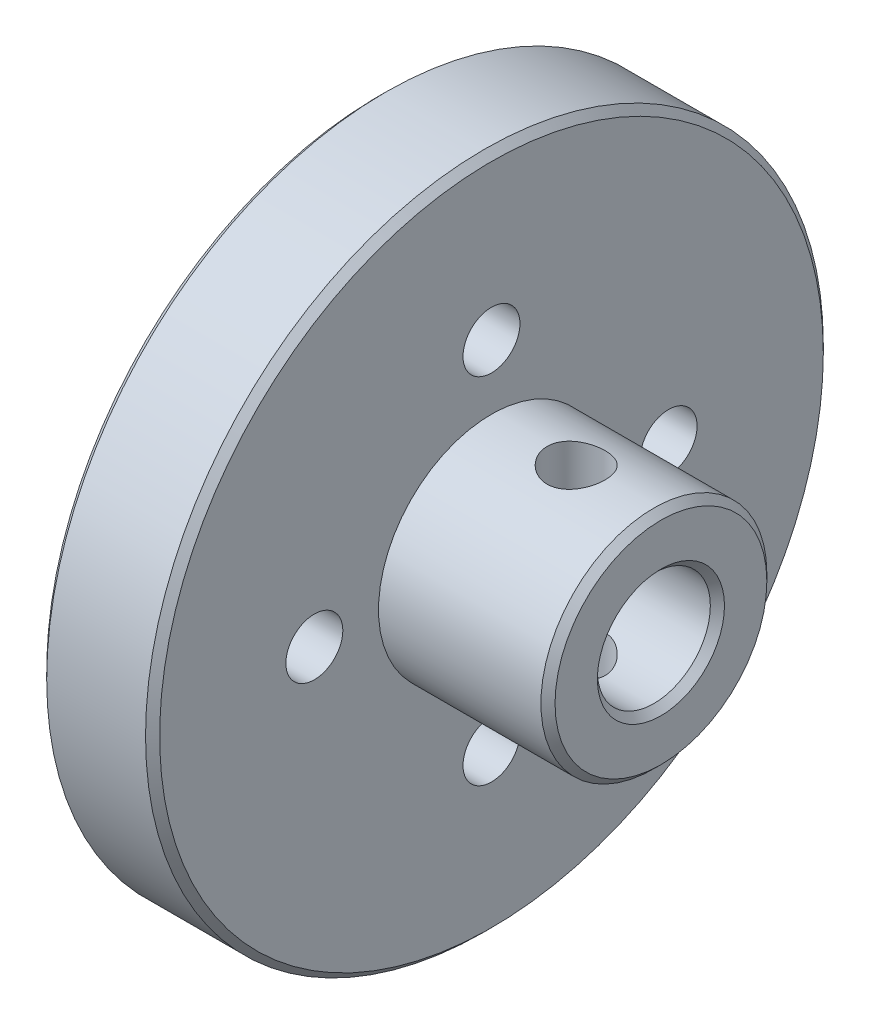
from build123d import *

# Parameters (mm, degrees)
CUT_EXTRUDE1_DEPTH      = 32.270123521
CUT_EXTRUDE1_DEPTH_BACK = 32.270123521
SKETCH3_R               = 1.63195
SKETCH2_R               = 1.6
CUT_EXTRUDE2_DEPTH      = 32.270123571
CHAMFER1_SIZE           = 0.396875


with BuildPart() as part:
    # Sketch1 → Revolve1 (revolve)
    with BuildSketch(Plane.XY):
        Polygon((0, 3.175), (0, 6.35), (-9.525, 6.35), (-9.525, 19.05), (-15.875, 19.05), (-15.875, 4.5), (-14.0716, 4.5), (-14.0716, 3.175), align=None)
    revolve(axis=Axis((0, 0, 0), (-1, 0, 0)))

    # Sketch3 → Cut-Extrude1 (cut, two sides: drawn at the far end of the back side and taken through both)
    with BuildSketch(Plane(origin=(0, 0, 0), x_dir=(1, 0, 0), z_dir=(0, 1, 0)).offset(-CUT_EXTRUDE1_DEPTH_BACK)):
        with Locations((-4.7625, 0)):
            Circle(SKETCH3_R)
    extrude(amount=CUT_EXTRUDE1_DEPTH + CUT_EXTRUDE1_DEPTH_BACK, mode=Mode.SUBTRACT)

    # Sketch2 → Cut-Extrude2 (cut, through all)
    with BuildSketch(Plane.ZY.offset(15.875)):
        with Locations((-9.9568, 0)):
            Circle(SKETCH2_R)
        with Locations((0, 9.9568)):
            Circle(SKETCH2_R)
        with Locations((9.9568, 0)):
            Circle(SKETCH2_R)
        with Locations((0, -9.9568)):
            Circle(SKETCH2_R)
    extrude(amount=-CUT_EXTRUDE2_DEPTH, mode=Mode.SUBTRACT)

    # Chamfer1
    chamfer1_edges = [part.edges().sort_by_distance(p)[0] for p in [
        (0, -3.175, 0),
        (0, -6.35, 0),
        (-9.525, -19.05, 0),
        (-15.875, -19.05, 0),
    ]]
    chamfer(chamfer1_edges, length=CHAMFER1_SIZE)


solid = part.part
